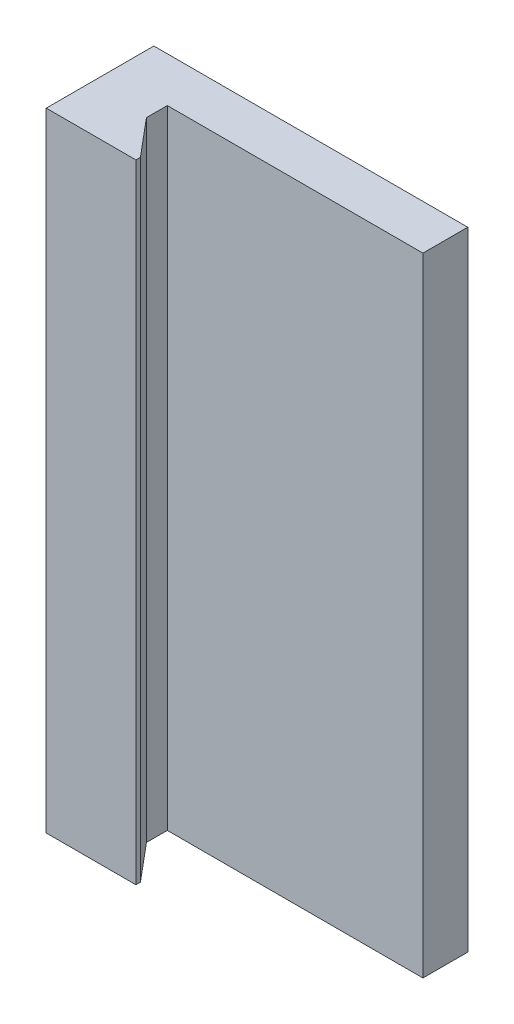
from build123d import *

# Parameters (mm, degrees)
SKETCH_1_W          = 35
SKETCH_1_H          = 70
EXTRUDE_1_DEPTH     = 12
CUT_EXTRUDE_1_REACH = 81.177


with BuildPart() as part:
    # 草图1 → 凸台-拉伸1 (new body)
    with BuildSketch(Plane.XY):
        with Locations((17.5, -35)):
            Rectangle(SKETCH_1_W, SKETCH_1_H)
    extrude(amount=EXTRUDE_1_DEPTH)

    # 草图2 → 切除-拉伸1 (cut, up to next)
    with BuildSketch(Plane.XZ.offset(70), mode=Mode.PRIVATE) as cut_extrude_1_sk1:
        Polygon((10, 12), (10, 11.5), (6.5, 7.328862426), (6.5, 5), (35, 5), (35, 12), align=None)
    cut_extrude_1_tool1 = extrude(cut_extrude_1_sk1.sketch, amount=-CUT_EXTRUDE_1_REACH, mode=Mode.PRIVATE) & part.part
    add(cut_extrude_1_tool1.solids().sort_by_distance((21.366311, -70, 8.408444))[0], mode=Mode.SUBTRACT)


solid = part.part
